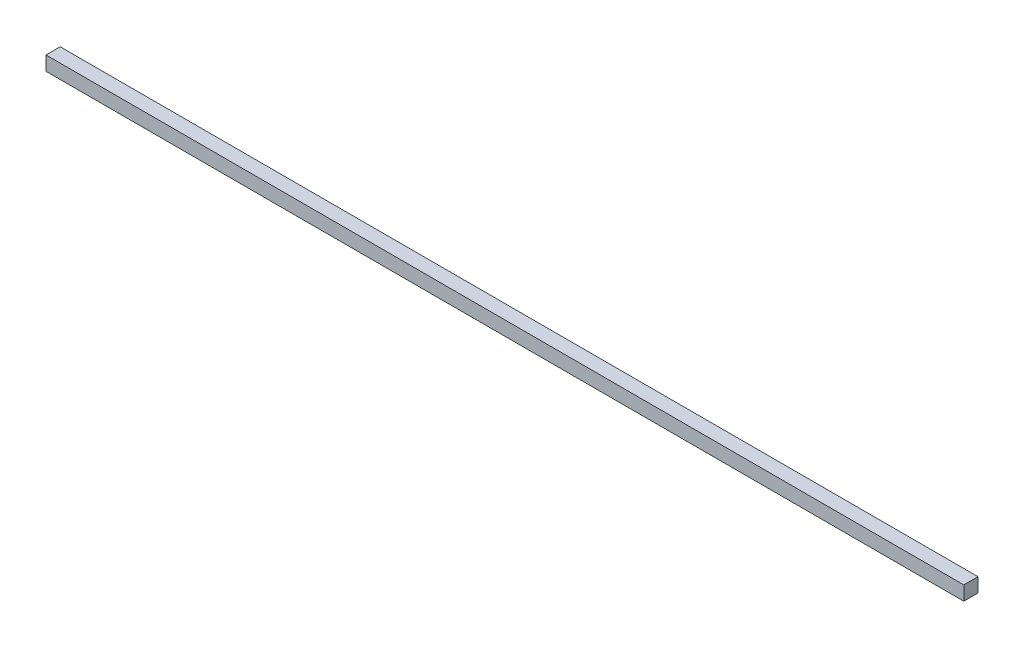
from build123d import *

# Parameters (mm, degrees)
SKETCH1_W           = 97
SKETCH1_H           = 1.5
BOSS_EXTRUDE1_DEPTH = 1.5
SCALE1_SCALE        = 10


with BuildPart() as part:
    # Sketch1 → Boss-Extrude1 (new body)
    with BuildSketch(Plane.XY):
        with Locations((48.5, 0.75)):
            Rectangle(SKETCH1_W, SKETCH1_H)
    extrude(amount=BOSS_EXTRUDE1_DEPTH)


with BuildPart() as part_1:
    # Scale1: scaled about (0, 0, 0)
    add(part.part.scale(SCALE1_SCALE))


solid = part_1.part
